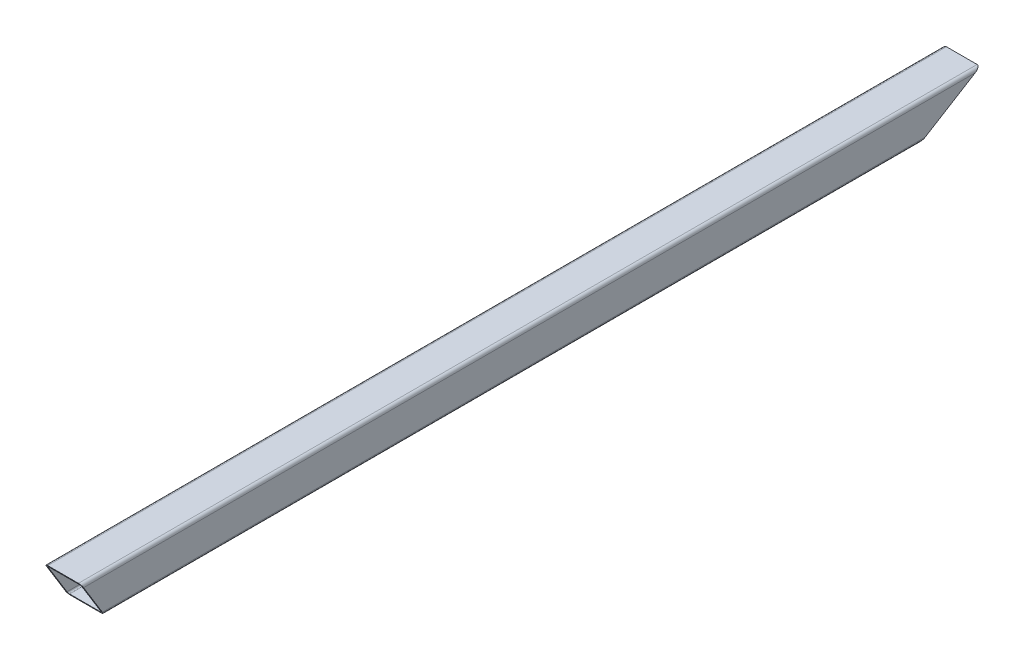
from build123d import *

# Parameters (mm, degrees)
BOSS_EXTRUDE1_DEPTH = 1700
CUT_EXTRUDE1_DEPTH  = 1170


with BuildPart() as part:
    # Sketch1 → Boss-Extrude1 (new body)
    with BuildSketch(Plane.XY):
        with BuildLine():
            Line((22.630769231, 20.353846154), (-35.369230769, 20.353846154))
            ThreePointArc((-35.369230769, 20.353846154), (-39.611871456, 18.596486841), (-41.369230769, 14.353846154))
            Line((-41.369230769, 14.353846154), (-41.369230769, -43.646153846))
            ThreePointArc((-41.369230769, -43.646153846), (-39.611871456, -47.888794533), (-35.369230769, -49.646153846))
            Line((-35.369230769, -49.646153846), (22.630769231, -49.646153846))
            ThreePointArc((22.630769231, -49.646153846), (26.873409918, -47.888794533), (28.630769231, -43.646153846))
            Line((28.630769231, -43.646153846), (28.630769231, 14.353846154))
            ThreePointArc((28.630769231, 14.353846154), (26.873409918, 18.596486841), (22.630769231, 20.353846154))
        make_face()
        with BuildLine():
            Line((22.630769231, 17.353846154), (-35.369230769, 17.353846154))
            ThreePointArc((-35.369230769, 17.353846154), (-37.490551113, 16.475166497), (-38.369230769, 14.353846154))
            Line((-38.369230769, 14.353846154), (-38.369230769, -43.646153846))
            ThreePointArc((-38.369230769, -43.646153846), (-37.490551113, -45.76747419), (-35.369230769, -46.646153846))
            Line((-35.369230769, -46.646153846), (22.630769231, -46.646153846))
            ThreePointArc((22.630769231, -46.646153846), (24.752089574, -45.76747419), (25.630769231, -43.646153846))
            Line((25.630769231, -43.646153846), (25.630769231, 14.353846154))
            ThreePointArc((25.630769231, 14.353846154), (24.752089574, 16.475166497), (22.630769231, 17.353846154))
        make_face(mode=Mode.SUBTRACT)
    extrude(amount=BOSS_EXTRUDE1_DEPTH)

    # Sketch2 → Cut-Extrude1 (cut)
    with BuildSketch(Plane(origin=(28.630769231, 0, 0), x_dir=(0, 0, -1), z_dir=(1, 0, 0))):
        Polygon((0, 20.353846154), (-114, -49.646153846), (0, -49.646153846), align=None)
        Polygon((-1700, 20.353846154), (-1657, -49.646153846), (-1700, -49.646153846), align=None)
    extrude(amount=-CUT_EXTRUDE1_DEPTH, mode=Mode.SUBTRACT)


solid = part.part
